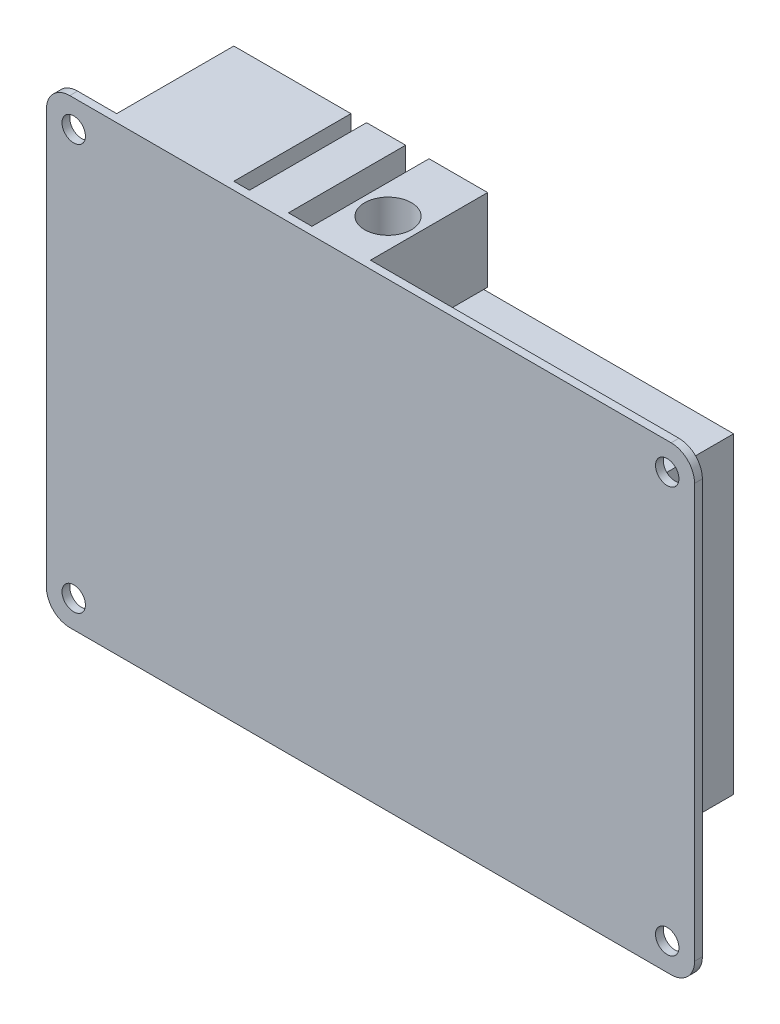
from build123d import *

# Parameters (mm, degrees)
SKETCH1_W           = 83
SKETCH1_H           = 59
SKETCH1_R           = 1.5
BOSS_EXTRUDE1_DEPTH = 1
SKETCH2_W           = 15
SKETCH2_H           = 21
SKETCH2_W_2         = 13
SKETCH2_H_2         = 17
SKETCH2_W_3         = 5
SKETCH2_H_3         = 19
SKETCH2_W_4         = 7.5
SKETCH2_H_4         = 10.5
SKETCH2_W_5         = 40
SKETCH2_H_5         = 40
BOSS_EXTRUDE2_DEPTH = 15
SKETCH3_R           = 3
CUT_EXTRUDE1_DEPTH  = 5
SKETCH4_W           = 11
SKETCH4_H           = 5
CUT_EXTRUDE2_DEPTH  = 10
FILLET1_R           = 3


with BuildPart() as part:
    # Sketch1 → Boss-Extrude1 (new body)
    with BuildSketch(Plane.XY):
        with Locations((6.725862069, -19.339655172)):
            Rectangle(SKETCH1_W, SKETCH1_H)
        with Locations((-31.274137931, 6.660344828)):
            Circle(SKETCH1_R, mode=Mode.SUBTRACT)
        with Locations((44.725862069, 6.660344828)):
            Circle(SKETCH1_R, mode=Mode.SUBTRACT)
        with Locations((44.725862069, -45.339655172)):
            Circle(SKETCH1_R, mode=Mode.SUBTRACT)
        with Locations((-31.274137931, -45.339655172)):
            Circle(SKETCH1_R, mode=Mode.SUBTRACT)
    extrude(amount=BOSS_EXTRUDE1_DEPTH)

    # Sketch2 → Boss-Extrude2 (add)
    with BuildSketch(Plane(origin=(0, 0, 0), x_dir=(-1, 0, 0), z_dir=(0, 0, -1))):
        with Locations((19.274137931, -0.339655172)):
            Rectangle(SKETCH2_W, SKETCH2_H)
        with Locations((20.274137931, -40.339655172)):
            Rectangle(SKETCH2_W_2, SKETCH2_H_2)
        with Locations((7.274137931, 0.660344828)):
            Rectangle(SKETCH2_W_3, SKETCH2_H_3)
        with Locations((-1.975862069, 4.910344828)):
            Rectangle(SKETCH2_W_4, SKETCH2_H_4)
        with Locations((-17.225862069, -20.839655172)):
            Rectangle(SKETCH2_W_5, SKETCH2_H_5)
    extrude(amount=BOSS_EXTRUDE2_DEPTH)

    # Sketch3 → Cut-Extrude1 (cut)
    with BuildSketch(Plane(origin=(0, 10.160344828, 0), x_dir=(1, 0, 0), z_dir=(0, 1, 0))):
        with Locations(Location((1.975862069, 6, 0), (0, 0, 270))):
            Circle(SKETCH3_R)
    extrude(amount=-CUT_EXTRUDE1_DEPTH, mode=Mode.SUBTRACT)

    # Sketch4 → Cut-Extrude2 (cut)
    with BuildSketch(Plane.XZ.offset(48.839655172)):
        with Locations((-20.274137931, -4.5)):
            Rectangle(SKETCH4_W, SKETCH4_H)
        with Locations((-20.274137931, -11.5)):
            Rectangle(SKETCH4_W, SKETCH4_H)
    extrude(amount=-CUT_EXTRUDE2_DEPTH, mode=Mode.SUBTRACT)

    # Fillet1
    fillet1_edges = [part.edges().sort_by_distance(p)[0] for p in [
        (48.225862069, -48.839655172, 0.5),
        (-34.774137931, -48.839655172, 0.5),
        (-34.774137931, 10.160344828, 0.5),
        (48.225862069, 10.160344828, 0.5),
    ]]
    fillet(fillet1_edges, radius=FILLET1_R)


solid = part.part
